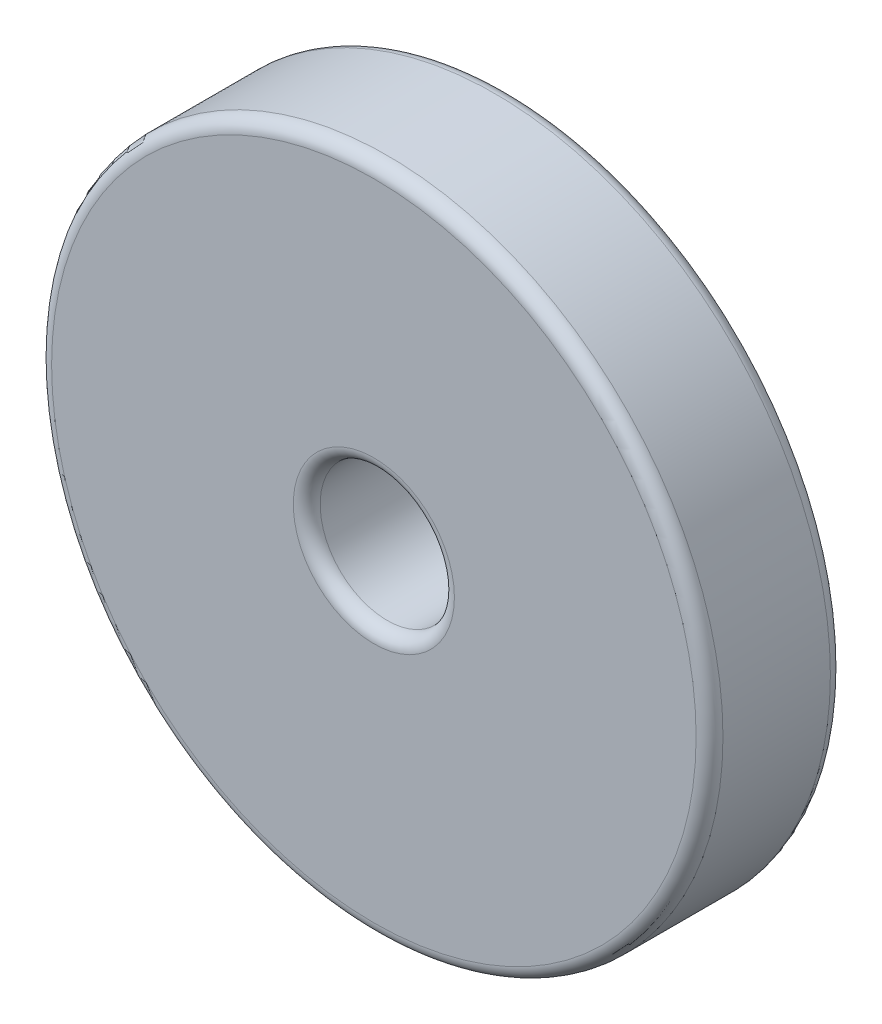
from build123d import *

# Parameters (mm, degrees)
SKETCH1_R           = 25
SKETCH1_R_2         = 5
BOSS_EXTRUDE1_DEPTH = 10
FILLET1_R           = 1
FILLET2_R           = 1


with BuildPart() as part:
    # Sketch1 → Boss-Extrude1 (new body)
    with BuildSketch(Plane.XY):
        Circle(SKETCH1_R)
        Circle(SKETCH1_R_2, mode=Mode.SUBTRACT)
    extrude(amount=BOSS_EXTRUDE1_DEPTH)

    # Fillet1
    fillet1_edges = [part.edges().sort_by_distance(p)[0] for p in [
        (-25, 0, 0),
        (-5, 0, 0),
        (-5, 0, 10),
    ]]
    fillet(fillet1_edges, radius=FILLET1_R)

    # Fillet2
    fillet2_edges = [part.edges().sort_by_distance(p)[0] for p in [
        (-25, 0, 10),
    ]]
    fillet(fillet2_edges, radius=FILLET2_R)


solid = part.part
